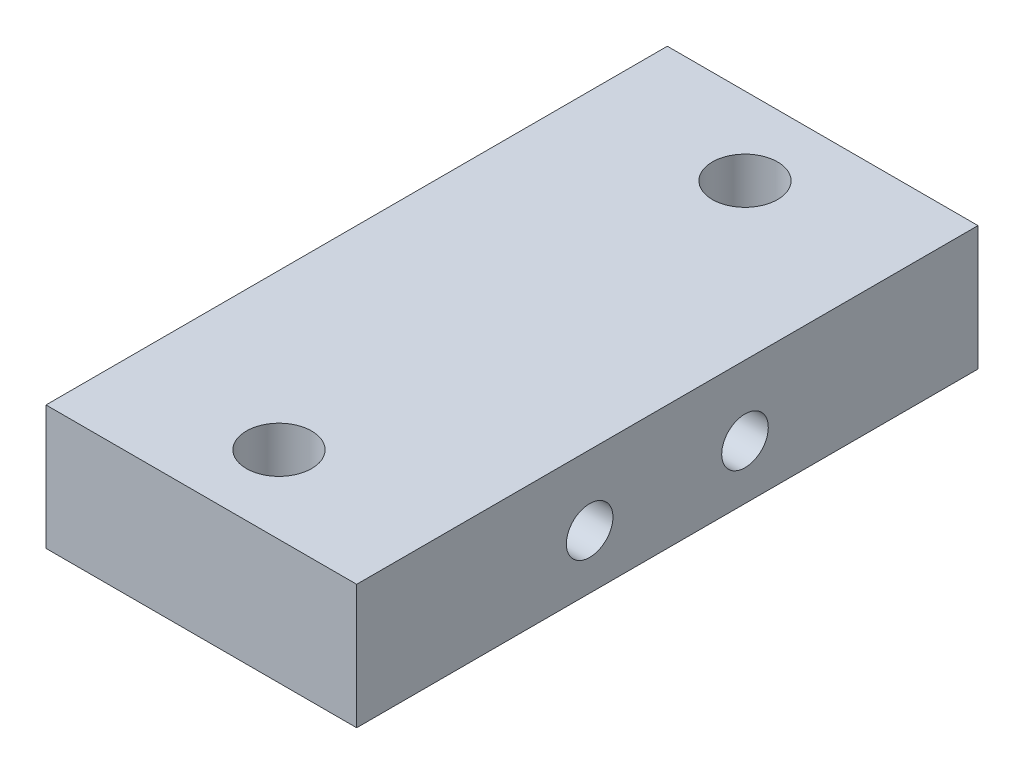
from build123d import *

# Parameters (mm, degrees)
SKETCH2_W           = 20
SKETCH2_H           = 40
BOSS_EXTRUDE2_DEPTH = 8
SKETCH3_R           = 2.1
CUT_EXTRUDE1_DEPTH  = 8
SKETCH4_R           = 1.5
CUT_EXTRUDE2_DEPTH  = 15


with BuildPart() as part:
    # Sketch2 → Boss-Extrude2 (new body)
    with BuildSketch(Plane(origin=(0, 33.757283518, 0), x_dir=(1, 0, 0), z_dir=(0, 1, 0))):
        with Locations((-80, 30.5)):
            Rectangle(SKETCH2_W, SKETCH2_H)
    extrude(amount=BOSS_EXTRUDE2_DEPTH)

    # Sketch3 → Cut-Extrude1 (cut)
    with BuildSketch(Plane(origin=(0, 41.757283518, 0), x_dir=(1, 0, 0), z_dir=(0, 1, 0))):
        with Locations(Location((-80, 15.5, 0), (0, 0, 270))):
            Circle(SKETCH3_R)
        with Locations(Location((-80, 45.5, 0), (0, 0, 270))):
            Circle(SKETCH3_R)
    extrude(amount=-CUT_EXTRUDE1_DEPTH, mode=Mode.SUBTRACT)

    # Sketch4 → Cut-Extrude2 (cut)
    with BuildSketch(Plane(origin=(-70, 0, 0), x_dir=(0, 0, -1), z_dir=(1, 0, 0))):
        with Locations(Location((25.5, 37.257283518, 0), (0, 0, 90))):
            Circle(SKETCH4_R)
        with Locations(Location((35.5, 37.257283518, 0), (0, 0, 90))):
            Circle(SKETCH4_R)
    extrude(amount=-CUT_EXTRUDE2_DEPTH, mode=Mode.SUBTRACT)


solid = part.part
